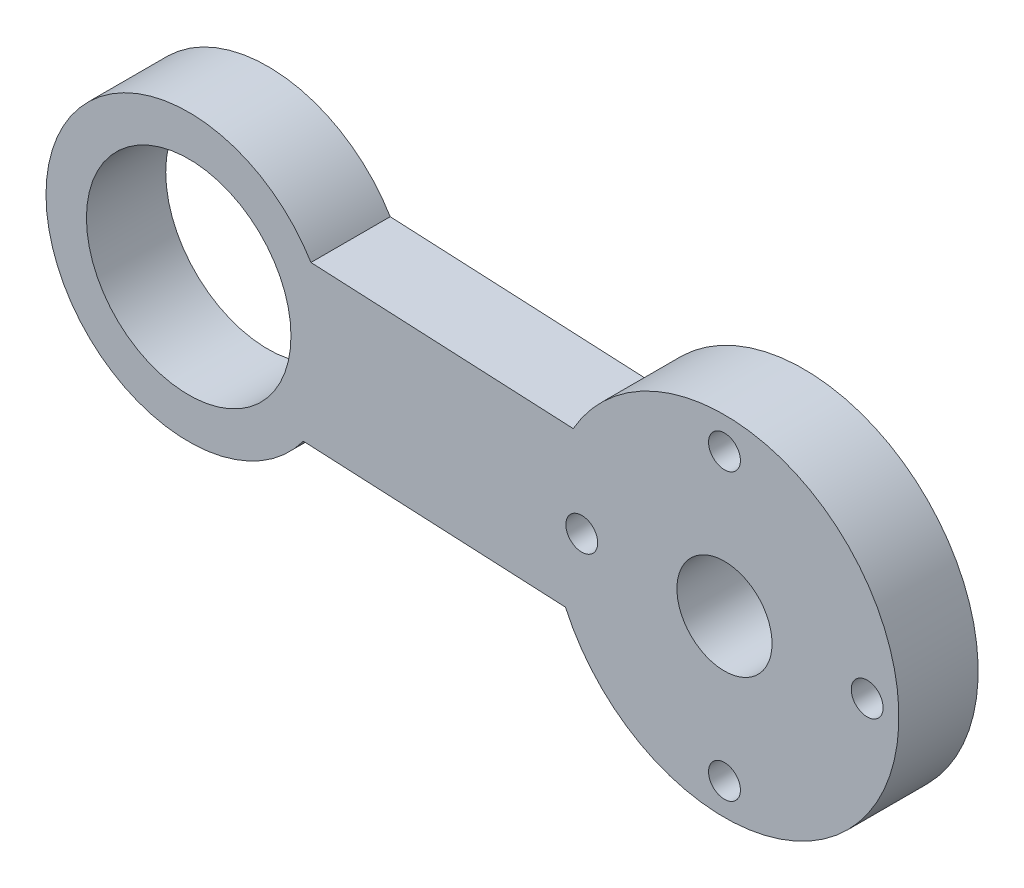
from build123d import *

# Parameters (mm, degrees)
BOSS_EXTRU_1_DEPTH      = 5
ESQUISSE2_R             = 1.005
ESQUISSE2_R_2           = 3
ENL_V_MAT_EXTRU_1_DEPTH = 6
ESQUISSE3_R             = 9
BOSS_EXTRU_2_DEPTH      = 5
ESQUISSE5_R             = 6.45
ENL_V_MAT_EXTRU_2_DEPTH = 6


with BuildPart() as part:
    # Esquisse1 → Boss.-Extru.1 (new body)
    with BuildSketch(Plane.XY):
        with BuildLine():
            Line((-10.02588737, -4.525658234), (-40.02588737, -3.070914704))
            Line((-40.02588737, -3.070914704), (-39.541047229, 6.929085296))
            Line((-39.541047229, 6.929085296), (-9.541047229, 5.474341766))
            ThreePointArc((-9.541047229, 5.474341766), (10.987093901, -0.532698415), (-10.02588737, -4.525658234))
        make_face()
    extrude(amount=BOSS_EXTRU_1_DEPTH)

    # Esquisse2 → Enlèv. mat.-Extru.1 (cut)
    with BuildSketch(Plane.XY.offset(5)):
        with Locations((0, 9)):
            Circle(ESQUISSE2_R)
        with Locations((9, 0)):
            Circle(ESQUISSE2_R)
        with Locations((0, -9)):
            Circle(ESQUISSE2_R)
        with Locations((-9, 0)):
            Circle(ESQUISSE2_R)
        with Locations((-33.790793572, 1.632611651)):
            Circle(ESQUISSE2_R)
        Circle(ESQUISSE2_R_2)
    extrude(amount=-ENL_V_MAT_EXTRU_1_DEPTH, mode=Mode.SUBTRACT)

    # Esquisse3 → Boss.-Extru.2 (add)
    with BuildSketch(Plane(origin=(0, 0, 0), x_dir=(-1, 0, 0), z_dir=(0, 0, -1))):
        with Locations((33.790793572, 1.632611651)):
            Circle(ESQUISSE3_R)
    extrude(amount=-BOSS_EXTRU_2_DEPTH)

    # Esquisse5 → Enlèv. mat.-Extru.2 (cut)
    with BuildSketch(Plane(origin=(0, 0, 0), x_dir=(-1, 0, 0), z_dir=(0, 0, -1))):
        with Locations((33.790793572, 1.632611651)):
            Circle(ESQUISSE5_R)
    extrude(amount=-ENL_V_MAT_EXTRU_2_DEPTH, mode=Mode.SUBTRACT)


solid = part.part
